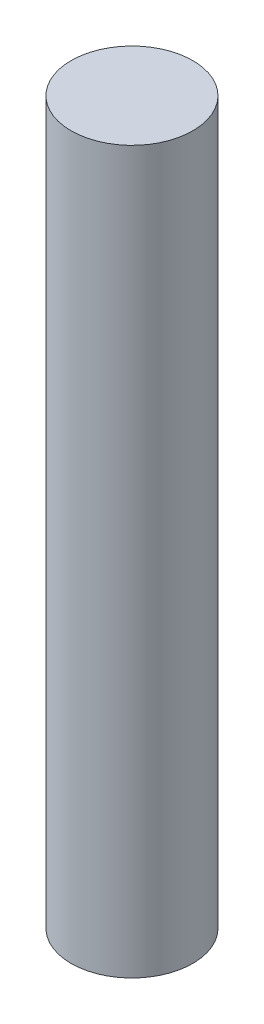
from build123d import *

# Parameters (mm, degrees)
SKETCH_1_R      = 1.35
EXTRUDE_1_DEPTH = 16


with BuildPart() as part:
    # 草图1 → 凸台-拉伸1 (new body)
    with BuildSketch(Plane(origin=(0, 0, 0), x_dir=(1, 0, 0), z_dir=(0, 1, 0))):
        with Locations(Location((0, 0, 0), (0, 0, 270))):
            Circle(SKETCH_1_R)
    extrude(amount=EXTRUDE_1_DEPTH)


solid = part.part
